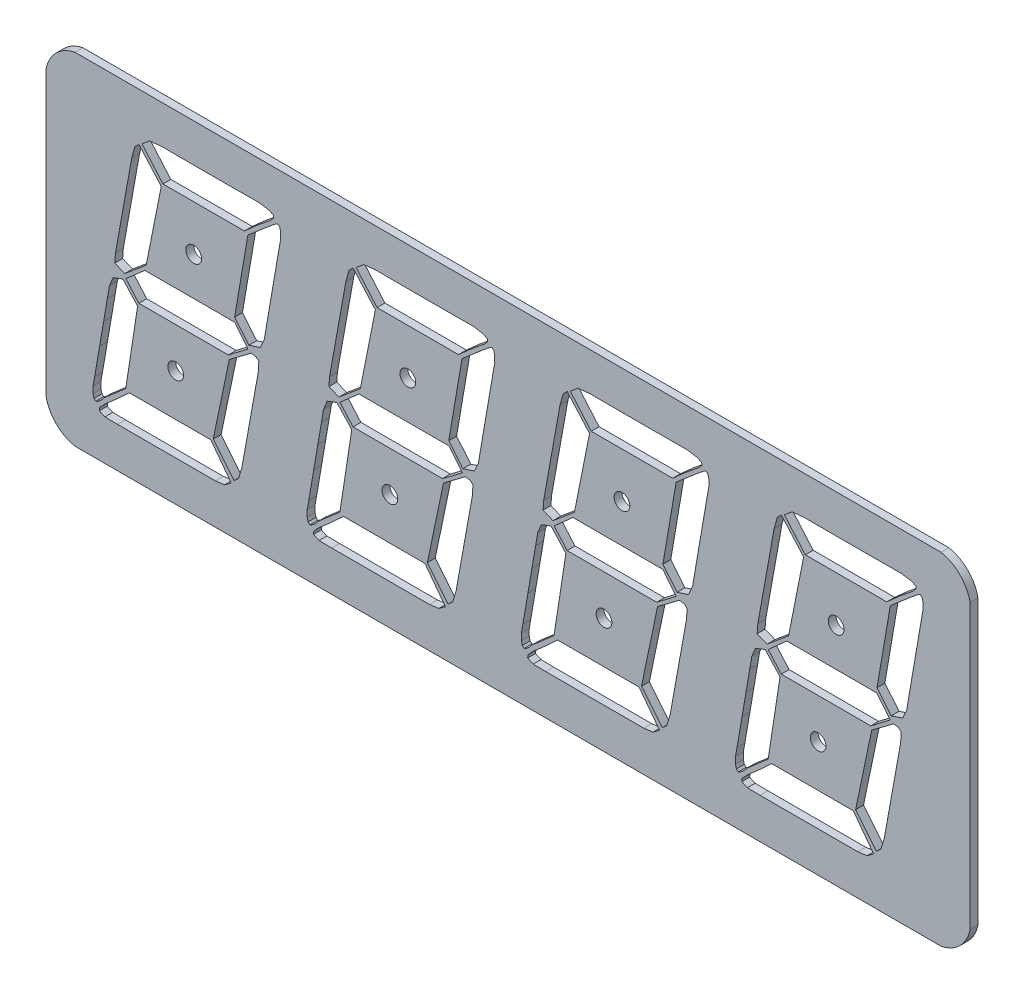
from build123d import *

# Parameters (mm, degrees)
MODEL_R                 = 3
SALIENTE_EXTRUIR1_DEPTH = 3


with BuildPart() as part:
    # Model → Saliente-Extruir1 (new body)
    with BuildSketch(Plane.XY):
        with BuildLine():
            Line((169.825482687, 67.503139244), (-160.174517313, 67.503139244))
            ThreePointArc((-160.174517313, 67.503139244), (-167.39341138, 63.661659725), (-171.234890898, 56.442765658))
            Line((-171.234890898, 56.442765658), (-171.234890898, -51.436487171))
            ThreePointArc((-171.234890898, -51.436487171), (-167.39341138, -58.655381238), (-160.174517313, -62.496860756))
            Line((-160.174517313, -62.496860756), (169.825482687, -62.496860756))
            ThreePointArc((169.825482687, -62.496860756), (177.044376754, -58.655381238), (180.885856273, -51.436487171))
            Line((180.885856273, -51.436487171), (180.885856273, 56.442765658))
            ThreePointArc((180.885856273, 56.442765658), (177.044376754, 63.661659725), (169.825482687, 67.503139244))
        make_face()
        with Locations((-114.944890898, 23.453139244)):
            Circle(MODEL_R, mode=Mode.SUBTRACT)
        with Locations((-121.804890898, -18.456860756)):
            Circle(MODEL_R, mode=Mode.SUBTRACT)
        with Locations((-33.354890898, 23.453139244)):
            Circle(MODEL_R, mode=Mode.SUBTRACT)
        with Locations((-40.214890898, -18.456860756)):
            Circle(MODEL_R, mode=Mode.SUBTRACT)
        with Locations((48.235109102, 23.453139244)):
            Circle(MODEL_R, mode=Mode.SUBTRACT)
        with Locations((41.375109102, -18.456860756)):
            Circle(MODEL_R, mode=Mode.SUBTRACT)
        with Locations((129.825109102, 23.453139244)):
            Circle(MODEL_R, mode=Mode.SUBTRACT)
        with Locations((122.965109102, -18.456860756)):
            Circle(MODEL_R, mode=Mode.SUBTRACT)
        Polygon((148.198064611, -37.550875054), (154.410995188, -3.061050901), (154.621469008, 0.643091205), (153.565763866, 1.569126732), (151.736077115, 1.877805241), (143.381439144, -4.391827736), (137.264354196, -33.69803263), (145.164203639, -43.465977921), (146.900289727, -41.902341101), align=None, mode=Mode.SUBTRACT)
        Polygon((106.203373716, 43.485810668), (99.990471773, 8.995399026), (99.743679513, 5.606200846), (103.543576047, 4.05775599), (111.713317662, 10.90967965), (117.448880902, 39.770674791), (108.93833862, 49.371192447), (107.407805996, 47.827657272), align=None, mode=Mode.SUBTRACT)
        Polygon((150.469615119, 40.218310755), (145.404292719, 10.600944277), (150.825556562, 4.05775599), (155.156530095, 5.450224581), (156.712230489, 8.871662255), (157.494427192, 13.481942924), (158.89394053, 21.659324679), (160.426642915, 30.586840953), (162.340458677, 41.716496162), (162.937463119, 45.065991337), (162.9220808, 47.519993314), (162.569144192, 48.912367885), (161.867955262, 49.537387914), (161.757784207, 49.528170624), (161.634988635, 49.483724618), (161.336405805, 49.322925876), (160.550336256, 48.776120483), (158.340244201, 46.971669587), align=None, mode=Mode.SUBTRACT)
        Polygon((96.108492658, -42.771477835), (94.01107431, -44.97455341), (93.873348916, -46.144522673), (95.973604314, -47.124291432), (100.842055127, -47.173838029), (138.109263227, -47.173838029), (141.593848475, -46.730662412), (144.137796209, -44.884707777), (136.34118084, -34.511441859), (105.303267714, -34.511441859), (100.112015249, -39.277826897), align=None, mode=Mode.SUBTRACT)
        Polygon((143.017507467, -3.163580254), (150.469615119, 2.503139244), (145.320190272, 8.839912016), (111.039039345, 8.839912016), (103.977343302, 2.503139244), (108.922568248, -3.163580254), align=None, mode=Mode.SUBTRACT)
        Polygon((159.063156888, 49.275941729), (160.285762294, 50.636363831), (160.196371576, 51.463128463), (158.75768815, 52.300429145), (154.753025815, 52.948012356), (142.530055194, 52.904982773), (132.606917686, 52.885849914), (123.303769089, 52.896060382), (117.726024434, 52.944979592), (112.986474893, 52.439492079), (110.127743528, 50.032919618), (118.087580996, 40.807251591), (149.125494123, 40.807251591), (153.985928811, 45.135179507), align=None, mode=Mode.SUBTRACT)
        Polygon((66.606637285, -37.582625293), (72.81948947, -3.092801141), (73.02996329, 0.611340966), (71.974258149, 1.537376492), (70.144590184, 1.846055001), (61.789933426, -4.423577976), (55.672848478, -33.729782869), (63.572697921, -43.49772816), (65.308784009, -41.93409134), align=None, mode=Mode.SUBTRACT)
        Polygon((24.611856982, 43.454060428), (18.398966055, 8.963648786), (18.152173795, 5.574450606), (21.952148721, 4.02600575), (30.121811944, 10.87792941), (35.857375184, 39.738924552), (27.346832903, 49.339442208), (25.816300278, 47.795907033), align=None, mode=Mode.SUBTRACT)
        Polygon((68.878109401, 40.186560516), (63.812787001, 10.569194037), (69.234129236, 4.02600575), (73.565024377, 5.418474341), (75.120743558, 8.839912016), (75.902921474, 13.450192685), (77.302434812, 21.62757444), (78.835137197, 30.555090713), (80.748912141, 41.684745922), (81.345957401, 45.034241097), (81.330593869, 47.488243075), (80.977638474, 48.880617646), (80.276449545, 49.505637674), (80.166278489, 49.496420385), (80.043482917, 49.451974379), (79.744900087, 49.291175636), (78.958830538, 48.744370243), (76.748738483, 46.939919347), align=None, mode=Mode.SUBTRACT)
        Polygon((14.517005727, -42.771477835), (12.419568592, -44.97455341), (12.281843198, -46.144522673), (14.382098596, -47.124291432), (19.250538394, -47.173838029), (56.517776296, -47.173838029), (60.002342757, -46.730662412), (62.546249673, -44.884707777), (54.749675122, -34.511441859), (23.711761996, -34.511441859), (18.520509531, -39.277826897), align=None, mode=Mode.SUBTRACT)
        Polygon((61.426001749, -3.163580254), (68.878109401, 2.503139244), (63.812787001, 8.839912016), (29.531636074, 8.839912016), (22.385837584, 2.503139244), (27.33106253, -3.163580254), align=None, mode=Mode.SUBTRACT)
        Polygon((77.471729562, 49.275941729), (78.694256576, 50.636363831), (78.604865858, 51.463128463), (77.166182432, 52.300429145), (73.161538884, 52.948012356), (60.938549476, 52.904982773), (51.015411968, 52.885849914), (41.712263372, 52.896060382), (36.134537503, 52.944979592), (31.394969175, 52.439492079), (28.536256597, 50.032919618), (36.496075278, 40.807251591), (67.533988405, 40.807251591), (72.394423093, 45.135179507), align=None, mode=Mode.SUBTRACT)
        Polygon((-14.984834745, -37.614375533), (-8.772016248, -3.12455138), (-8.561542428, 0.579590726), (-9.617247569, 1.505626253), (-11.446926549, 1.814304762), (-19.801572291, -4.455328215), (-25.91865724, -33.761533109), (-18.018807797, -43.5294784), (-16.282721708, -41.96584158), align=None, mode=Mode.SUBTRACT)
        Polygon((-56.979615047, 43.422310189), (-63.192539663, 8.931898547), (-63.439331923, 5.542700367), (-59.639353111, 3.994255511), (-51.469693773, 10.846179171), (-45.734130534, 39.707174313), (-54.244672815, 49.307691968), (-55.775205439, 47.764156793), align=None, mode=Mode.SUBTRACT)
        Polygon((-12.713396317, 40.154810276), (-17.778718717, 10.537443798), (-12.357357695, 3.994255511), (-8.026481341, 5.386724102), (-6.470758274, 8.808161776), (-5.688584244, 13.418442445), (-4.289070906, 21.5958242), (-2.756368521, 30.523340474), (-0.842559889, 41.652995683), (-0.245548316, 45.002490858), (-0.26087816, 47.456492835), (-0.613867244, 48.848867406), (-1.315056173, 49.473887435), (-1.425227229, 49.464670145), (-1.5480228, 49.420224139), (-1.846605631, 49.259425397), (-2.63267518, 48.712620004), (-4.842767235, 46.908169108), align=None, mode=Mode.SUBTRACT)
        Polygon((-67.074451401, -42.771477835), (-69.171937126, -44.97455341), (-69.30966252, -46.144522673), (-67.209407122, -47.124291432), (-62.340918734, -47.173838029), (-25.073729261, -47.173838029), (-21.589162961, -46.730662412), (-19.045207455, -44.884707777), (-26.841830595, -34.511441859), (-57.879743722, -34.511441859), (-63.070996187, -39.277826897), align=None, mode=Mode.SUBTRACT)
        Polygon((-20.165503969, -3.163580254), (-12.589790647, 2.503139244), (-17.706386191, 8.839912016), (-51.987537119, 8.839912016), (-59.205668134, 2.503139244), (-54.260443188, -3.163580254), align=None, mode=Mode.SUBTRACT)
        Polygon((-4.119757369, 49.275941729), (-2.897249142, 50.636363831), (-2.98663986, 51.463128463), (-4.425323286, 52.300429145), (-8.429933145, 52.948012356), (-20.652956242, 52.904982773), (-30.57609375, 52.885849914), (-39.879242346, 52.896060382), (-45.456934526, 52.944979592), (-50.196536543, 52.439492079), (-53.055215433, 50.032919618), (-45.095430439, 40.807251591), (-14.057517313, 40.807251591), (-9.197082625, 45.135179507), align=None, mode=Mode.SUBTRACT)
        Polygon((-96.576276973, -37.646125772), (-90.363521966, -3.15630162), (-90.153048146, 0.547840487), (-91.208753287, 1.473876013), (-93.03841348, 1.782554522), (-101.393078009, -4.487078455), (-107.510162958, -33.793283348), (-99.610313515, -43.561228639), (-97.874227426, -41.997591819), align=None, mode=Mode.SUBTRACT)
        Polygon((-138.571087077, 43.390559949), (-144.784045381, 8.900148307), (-145.030837641, 5.510950127), (-141.230825141, 3.962505271), (-133.061199491, 10.814428931), (-127.325636252, 39.675424073), (-135.836178533, 49.275941729), (-137.366711157, 47.732406554), align=None, mode=Mode.SUBTRACT)
        Polygon((-94.304902035, 40.123060037), (-99.370224435, 10.505693558), (-93.948844626, 3.962505271), (-89.617987059, 5.354973862), (-88.062260106, 8.776411537), (-87.280089962, 13.386692206), (-85.880576624, 21.564073961), (-84.347874239, 30.491590234), (-82.434031918, 41.621245443), (-81.837054034, 44.970740618), (-81.85235019, 47.424742596), (-82.205372962, 48.817117167), (-82.906561891, 49.442137195), (-83.016732947, 49.432919906), (-83.139528518, 49.3884739), (-83.438111349, 49.227675157), (-84.224180897, 48.680869764), (-86.434272953, 46.876418868), align=None, mode=Mode.SUBTRACT)
        Polygon((-148.665968135, -42.771477835), (-150.763442844, -44.97455341), (-150.901168238, -46.144522673), (-148.80091284, -47.124291432), (-143.932405665, -47.173838029), (-106.665197566, -47.173838029), (-103.180668679, -46.730662412), (-100.636664584, -44.884707777), (-108.433336313, -34.511441859), (-139.47124944, -34.511441859), (-144.662501905, -39.277826897), align=None, mode=Mode.SUBTRACT)
        Polygon((-101.757009687, -3.163580254), (-94.304902035, 2.503139244), (-99.297891909, 8.839912016), (-133.579042837, 8.839912016), (-140.797173852, 2.503139244), (-135.851948906, -3.163580254), align=None, mode=Mode.SUBTRACT)
        Polygon((-85.7112443, 49.275941729), (-84.48875486, 50.636363831), (-84.578145578, 51.463128463), (-86.016829004, 52.300429145), (-90.021405175, 52.948012356), (-102.24446196, 52.904982773), (-112.167599468, 52.885849914), (-121.470748064, 52.896060382), (-127.048436358, 52.944979592), (-131.788042261, 52.439492079), (-134.646717265, 50.032919618), (-126.686936157, 40.807251591), (-95.649023031, 40.807251591), (-90.788588343, 45.135179507), align=None, mode=Mode.SUBTRACT)
        with BuildLine():
            Line((103.931245289, -33.700458841), (108.446424303, -4.26687786))
            Line((108.446424303, -4.26687786), (102.803643987, 1.889936296))
            Line((102.803643987, 1.889936296), (99.096727389, 0.487685221))
            Line((99.096727389, 0.487685221), (97.69039993, -2.936101025))
            Line((97.69039993, -2.936101025), (96.908395536, -7.546476802))
            Line((96.908395536, -7.546476802), (95.509310181, -15.72414388))
            Line((95.509310181, -15.72414388), (93.977144232, -24.652017777))
            Line((93.977144232, -24.652017777), (92.064019487, -35.782148038))
            Line((92.064019487, -35.782148038), (91.465080109, -39.130366055))
            Line((91.465080109, -39.130366055), (91.479893968, -41.584432084))
            Line((91.479893968, -41.584432084), (91.833878766, -42.977308823))
            Line((91.833878766, -42.977308823), (92.534724804, -43.601826684))
            ThreePointArc((92.534724804, -43.601826684), (94.201504073, -42.538926682), (95.484391052, -41.034895251))
            Line((95.484391052, -41.034895251), (103.931245289, -33.700458841))
        make_face(mode=Mode.SUBTRACT)
        with BuildLine():
            Line((22.339739571, -33.73220908), (26.854918585, -4.298628099))
            Line((26.854918585, -4.298628099), (21.212157056, 1.858186057))
            Line((21.212157056, 1.858186057), (17.505221671, 0.455934982))
            Line((17.505221671, 0.455934982), (16.098912999, -2.967851265))
            Line((16.098912999, -2.967851265), (15.316889818, -7.578227042))
            Line((15.316889818, -7.578227042), (13.917804463, -15.755894119))
            Line((13.917804463, -15.755894119), (12.385638514, -24.683768016))
            Line((12.385638514, -24.683768016), (10.472532556, -35.813898277))
            Line((10.472532556, -35.813898277), (9.873574391, -39.162116294))
            Line((9.873574391, -39.162116294), (9.888407037, -41.616182323))
            Line((9.888407037, -41.616182323), (10.242373048, -43.009059062))
            Line((10.242373048, -43.009059062), (10.943219086, -43.633576923))
            ThreePointArc((10.943219086, -43.633576923), (12.610002676, -42.570681886), (13.892885334, -41.066645491))
            Line((13.892885334, -41.066645491), (22.339739571, -33.73220908))
        make_face(mode=Mode.SUBTRACT)
        with BuildLine():
            Line((-59.251766147, -33.76395932), (-54.736587133, -4.330378339))
            Line((-54.736587133, -4.330378339), (-60.379344776, 1.826435817))
            Line((-60.379344776, 1.826435817), (-64.086284047, 0.424184742))
            Line((-64.086284047, 0.424184742), (-65.492573931, -2.999601504))
            Line((-65.492573931, -2.999601504), (-66.2746159, -7.609977281))
            Line((-66.2746159, -7.609977281), (-67.673701255, -15.787644359))
            Line((-67.673701255, -15.787644359), (-69.205867204, -24.715518256))
            Line((-69.205867204, -24.715518256), (-71.118954375, -35.845648517))
            Line((-71.118954375, -35.845648517), (-71.717931327, -39.193866534))
            Line((-71.717931327, -39.193866534), (-71.703079894, -41.647932563))
            Line((-71.703079894, -41.647932563), (-71.34913267, -43.040809302))
            Line((-71.34913267, -43.040809302), (-70.648286632, -43.665327163))
            ThreePointArc((-70.648286632, -43.665327163), (-68.981510412, -42.602423657), (-67.698620384, -41.09839573))
            Line((-67.698620384, -41.09839573), (-59.251766147, -33.76395932))
        make_face(mode=Mode.SUBTRACT)
        with BuildLine():
            Line((-140.843271865, -33.795709559), (-136.328092851, -4.362128578))
            Line((-136.328092851, -4.362128578), (-141.970816806, 1.794685578))
            Line((-141.970816806, 1.794685578), (-145.677789765, 0.392434503))
            Line((-145.677789765, 0.392434503), (-147.084060862, -3.031351744))
            Line((-147.084060862, -3.031351744), (-147.866121618, -7.641727521))
            Line((-147.866121618, -7.641727521), (-149.265206973, -15.819394598))
            Line((-149.265206973, -15.819394598), (-150.797372922, -24.747268495))
            Line((-150.797372922, -24.747268495), (-152.710441306, -35.877398756))
            Line((-152.710441306, -35.877398756), (-153.309437045, -39.225616773))
            Line((-153.309437045, -39.225616773), (-153.294566825, -41.679682802))
            Line((-153.294566825, -41.679682802), (-152.940638388, -43.072559541))
            Line((-152.940638388, -43.072559541), (-152.23979235, -43.697077402))
            ThreePointArc((-152.23979235, -43.697077402), (-150.573035194, -42.63415199), (-149.290126102, -41.13014597))
            Line((-149.290126102, -41.13014597), (-140.843271865, -33.795709559))
        make_face(mode=Mode.SUBTRACT)
    extrude(amount=SALIENTE_EXTRUIR1_DEPTH)


solid = part.part
